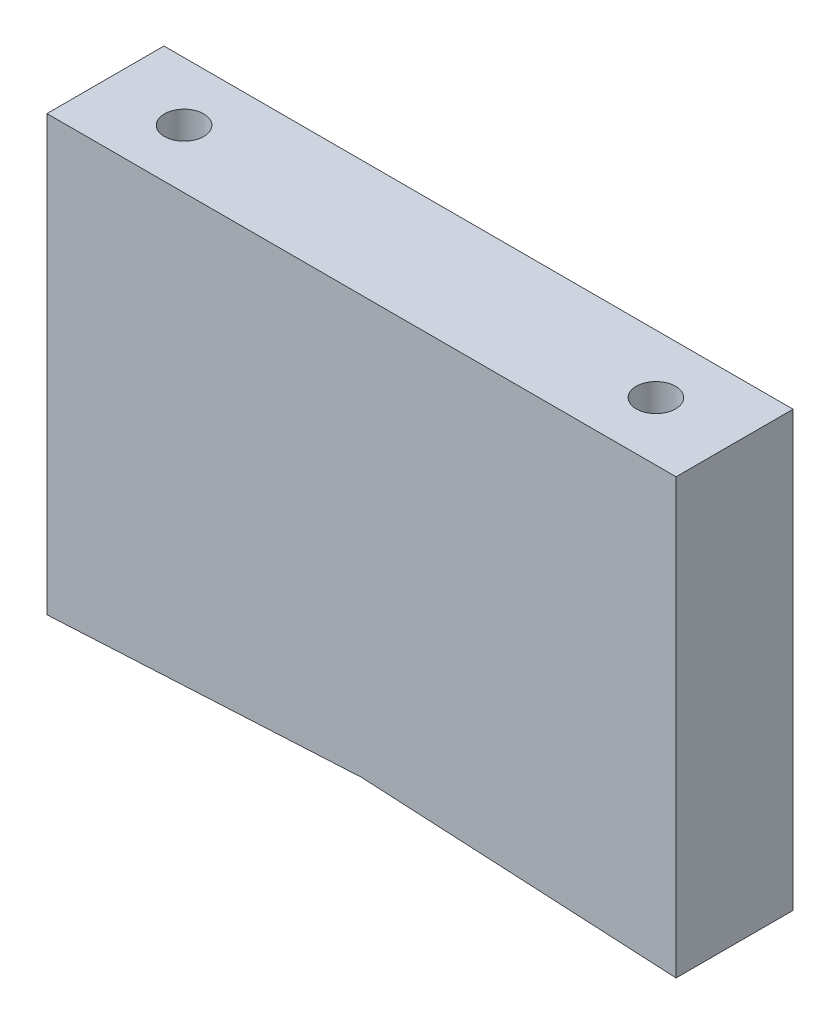
from build123d import *

# Parameters (mm, degrees)
SKETCH1_W             = 80
SKETCH1_H             = 14.88
BOSS_EXTRUDE1_DEPTH   = 55.2
CUT_EXTRUDE1_DEPTH    = 70.774310459
M6_TAPPED_HOLE1_D     = 5
M6_TAPPED_HOLE1_DEPTH = 15
M6_TAPPED_HOLE1_TIP   = 1.502151548


with BuildPart() as part:
    # Sketch1 → Boss-Extrude1 (new body)
    with BuildSketch(Plane(origin=(0, 0, 0), x_dir=(1, 0, 0), z_dir=(0, 1, 0))):
        Rectangle(SKETCH1_W, SKETCH1_H)
    extrude(amount=-BOSS_EXTRUDE1_DEPTH)

    # Sketch3 → Cut-Extrude1 (cut, through all)
    with BuildSketch(Plane(origin=(0, 0, -7.44), x_dir=(-1, 0, 0), z_dir=(0, 0, -1))):
        Polygon((40, -55.2), (0, -53.103688829), (-40, -55.2), align=None)
    extrude(amount=-CUT_EXTRUDE1_DEPTH, mode=Mode.SUBTRACT)

    # M6 Tapped Hole1
    with Locations(Plane(origin=(0, 0, 0), x_dir=(1, 0, 0), z_dir=(0, 1, 0))):
        with Locations((-30, 0), (30, 0)):
            Hole(M6_TAPPED_HOLE1_D / 2, depth=M6_TAPPED_HOLE1_DEPTH)
            with Locations((0, 0, -(M6_TAPPED_HOLE1_DEPTH + M6_TAPPED_HOLE1_TIP / 2))):  # 118° drill point
                Cone(0, M6_TAPPED_HOLE1_D / 2, M6_TAPPED_HOLE1_TIP, mode=Mode.SUBTRACT)


solid = part.part
